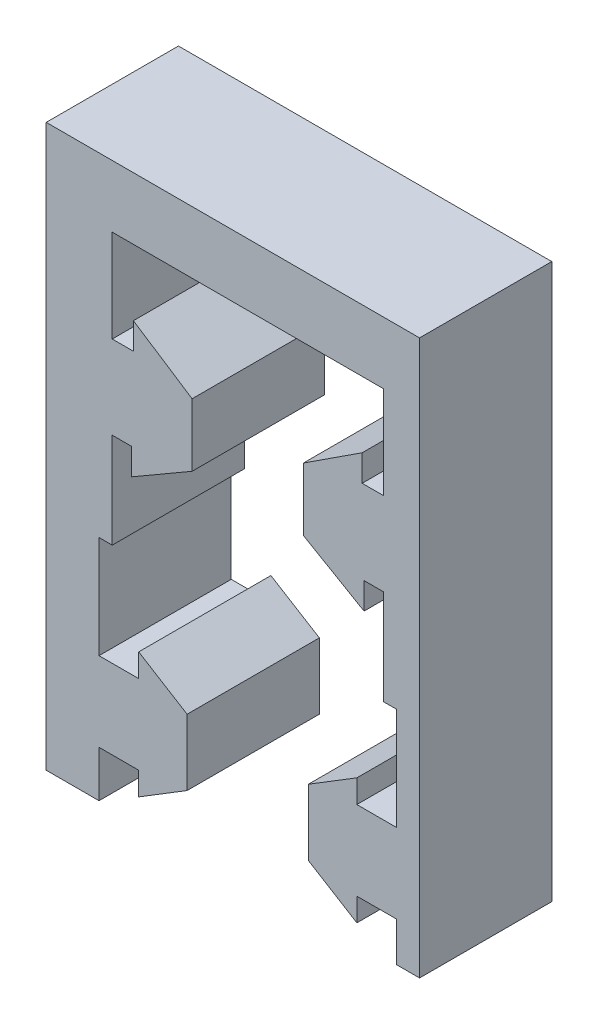
from build123d import *

# Parameters (mm, degrees)
Y_KSEKLIK_EKSTR_ZYON2_DEPTH = 10


with BuildPart() as part:
    # Çizim1 → Yükseklik-Ekstrüzyon2 (new body)
    with BuildSketch(Plane.XY):
        Polygon((-25.492927237, -16.741209148), (-25.492927237, 25.69490809), (2.74162316, 25.69490809), (2.74162316, -16.230491935), (1, -16.230491935), (1, -13.241209148), (-2, -13.241209148), (-2, -14.991209148), (-5.664355332, -12.741209148), (-5.664355332, -7.741209148), (-2, -5.491209148), (-2, -7.241209148), (1, -7.241209148), (1, 0.5), (0, 0.5), (0, 7.7), (-1.45557311, 7.7), (-1.45557311, 5.7), (-6.041140698, 8.357549603), (-6.041140698, 13.107549603), (-1.6, 16), (-1.6, 14), (0, 14), (0, 21), (-20.5, 21), (-20.5, 14), (-18.9, 14), (-18.9, 16), (-14.458859302, 13.107549603), (-14.458859302, 8.357549603), (-19.04442689, 5.7), (-19.04442689, 7.7), (-20.5, 7.7), (-20.5, 0.5), (-21.5, 0.5), (-21.5, -7.241209148), (-18.5, -7.241209148), (-18.5, -5.491209148), (-14.835644668, -7.741209148), (-14.835644668, -12.741209148), (-18.5, -14.991209148), (-18.5, -13.241209148), (-21.5, -13.241209148), (-21.5, -16.741209148), align=None)
    extrude(amount=Y_KSEKLIK_EKSTR_ZYON2_DEPTH)


solid = part.part
